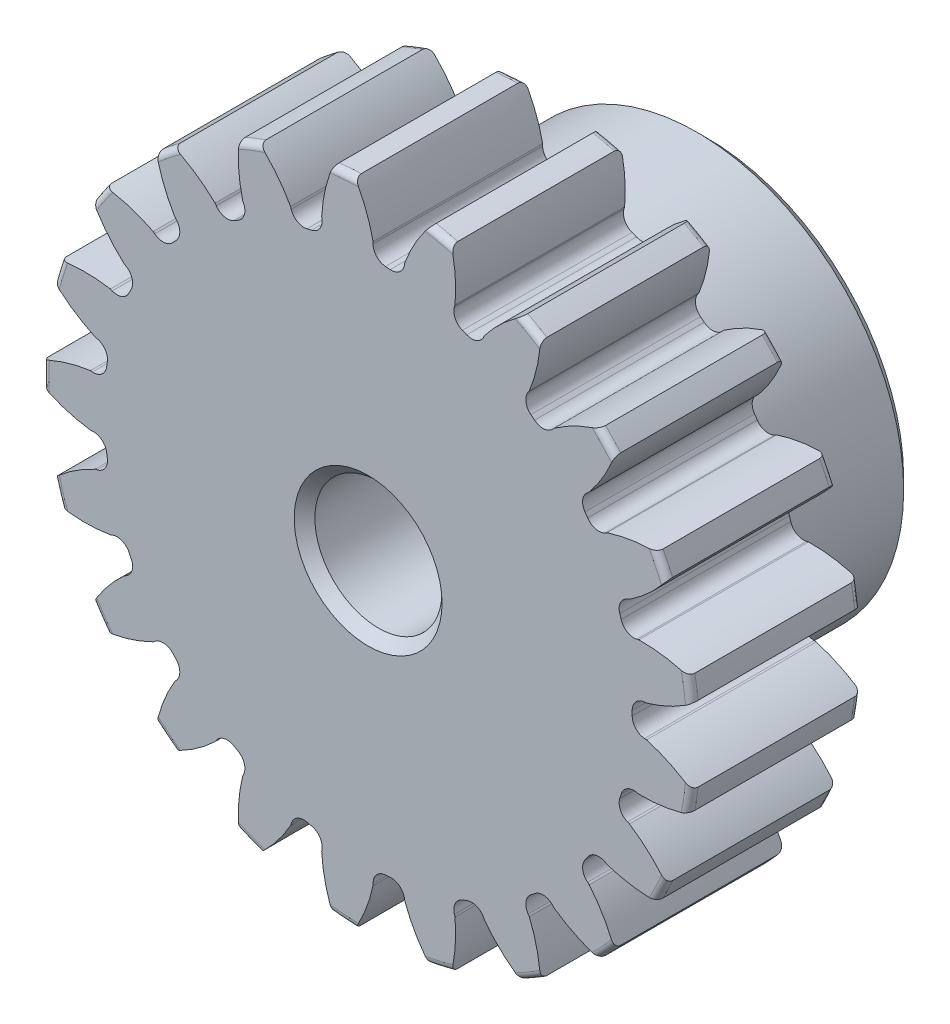
from build123d import *

# Parameters (mm, degrees)
SKETCH1_R                = 12.192
BOSS_EXTRUDE1_DEPTH      = 6.35
SKETCH2_W                = 6.35
SKETCH2_H                = 7.7390625
FILLET2_R                = 0.24384
CUT_EXTRUDE1_DEPTH       = 22.414474845
FILLET1_R                = 0.498729
CIRPATTERN1_COUNT        = 21
FILLET1_OF_CIRPATTERN1_R = 0.498729
SKETCH5_R                = 2.38125
CUT_EXTRUDE2_DEPTH       = 22.408687843
CHAMFER1_SIZE            = 0.386953125


with BuildPart() as part:
    # Sketch1 → Boss-Extrude1 (new body)
    with BuildSketch(Plane.XY):
        Circle(SKETCH1_R)
    extrude(amount=-BOSS_EXTRUDE1_DEPTH)

    # Sketch2 → Revolve1 (revolve)
    with BuildSketch(Plane(origin=(0, 0, 0), x_dir=(0, 0, -1), z_dir=(1, 0, 0)), mode=Mode.PRIVATE) as revolve1_sk:
        with Locations((9.525, 3.86953125)):
            Rectangle(SKETCH2_W, SKETCH2_H)
    revolve(revolve1_sk.sketch.rotate(Axis((0, 0, -6.35), (0, 0, -1)), 90), axis=Axis((0, 0, -6.35), (0, 0, -1)))

    # Fillet2
    fillet2_edges = [part.edges().sort_by_distance(p)[0] for p in [
        (-12.192, 0, 0),
        (-12.192, 0, -6.35),
        (-7.7390625, 0, -6.35),
    ]]
    fillet(fillet2_edges, radius=FILLET2_R)

    # Sketch4 → Cut-Extrude1 (cut, through all)
    with BuildSketch(Plane.XY):
        with BuildLine():
            Line((0.184470561, 10.440704726), (0.184470561, 9.886287443))
            ThreePointArc((0.184470561, 9.886287443), (0.738933513, 9.860359327), (1.291067936, 9.80335924))
            Line((1.291067936, 9.80335924), (1.373699736, 10.35158411))
            add(Edge.make_bspline(
                [(5.062757602, 13.879967568), (2.280636856, 12.773999339), (1.373699736, 10.35158411)],
                knots=[0, 0, 0, 1, 1, 1], degree=2))
            ThreePointArc((5.062757602, 13.879967568), (1.10410023, 14.733159095), (-2.937503896, 14.479505692))
            add(Edge.make_bspline(
                [(-2.937503896, 14.479505692), (-0.351293679, 12.971235729), (0.184470561, 10.440704726)],
                knots=[0, 0, 0, 1, 1, 1], degree=2))
        make_face()
    cut_extrude1 = extrude(amount=-CUT_EXTRUDE1_DEPTH, mode=Mode.SUBTRACT)

    # Fillet1
    fillet1_edges = [part.edges().sort_by_distance(p)[0] for p in [
        (1.291067936, 9.80335924, -3.175),
        (0.184470561, 9.886287443, -3.175),
    ]]
    fillet(fillet1_edges, radius=FILLET1_R)

    # CirPattern1: Cut-Extrude1 ×21 about axis
    cirpattern1_axis = Axis((0, 0, -6.35), (0, 0, 1))
    for i in range(1, CIRPATTERN1_COUNT):
        add(cut_extrude1.rotate(cirpattern1_axis, i * 360 / CIRPATTERN1_COUNT), mode=Mode.SUBTRACT)

    # Fillet1 of CirPattern1
    fillet1_of_cirpattern1_edges = [part.edges().sort_by_distance(p)[0] for p in [
        (-1.655881452, 9.74837245, -3.175),
        (-2.737759328, 9.501441084, -3.175),
        (-4.455698507, 8.827199987, -3.175),
        (-5.416727286, 8.272349987, -3.175),
        (-6.859607196, 7.121692069, -3.175),
        (-7.614395254, 6.308224292, -3.175),
        (-8.654009682, 4.783390557, -3.175),
        (-9.135490789, 3.783585185, -3.175),
        (-9.679465431, 2.020063802, -3.175),
        (-9.844857876, 0.92275793, -3.175),
        (-9.844858199, -0.922754486, -3.175),
        (-9.679466138, -2.020060416, -3.175),
        (-9.135492112, -3.783581989, -3.175),
        (-8.654011356, -4.783387529, -3.175),
        (-7.614397461, -6.308221628, -3.175),
        (-6.859609687, -7.121689669, -3.175),
        (-5.41673018, -8.272348092, -3.175),
        (-4.455701595, -8.827198429, -3.175),
        (-2.737762651, -9.501440126, -3.175),
        (-1.655884862, -9.74837187, -3.175),
        (0.184467103, -9.886287508, -3.175),
        (1.291064507, -9.803359691, -3.175),
        (3.090306146, -9.39269486, -3.175),
        (4.123297129, -8.987275983, -3.175),
        (5.721557926, -8.064520054, -3.175),
        (6.589156706, -7.372633363, -3.175),
        (7.844424176, -6.019777251, -3.175),
        (8.469540794, -5.102899914, -3.175),
        (9.270278913, -3.440150822, -3.175),
        (9.597369015, -2.379751415, -3.175),
        (9.872428687, -0.554851895, -3.175),
        (9.872428881, 0.554848441, -3.175),
        (9.597369847, 2.379748057, -3.175),
        (9.270280116, 3.440147579, -3.175),
        (8.469542579, 5.102896951, -3.175),
        (7.844426282, 6.019774507, -3.175),
        (6.589159285, 7.372631058, -3.175),
        (5.721560747, 8.064518052, -3.175),
        (4.123300273, 8.98727454, -3.175),
        (3.090309432, 9.392693778, -3.175),
    ]]
    fillet(fillet1_of_cirpattern1_edges, radius=FILLET1_OF_CIRPATTERN1_R)

    # Sketch5 → Cut-Extrude2 (cut, through all)
    with BuildSketch(Plane.XY):
        Circle(SKETCH5_R)
    extrude(amount=-CUT_EXTRUDE2_DEPTH, mode=Mode.SUBTRACT)

    # Chamfer1
    chamfer1_edges = [part.edges().sort_by_distance(p)[0] for p in [
        (-2.38125, 0, -12.7),
        (-2.38125, 0, 0),
        (-7.7390625, 0, -12.7),
    ]]
    chamfer(chamfer1_edges, length=CHAMFER1_SIZE)


solid = part.part
